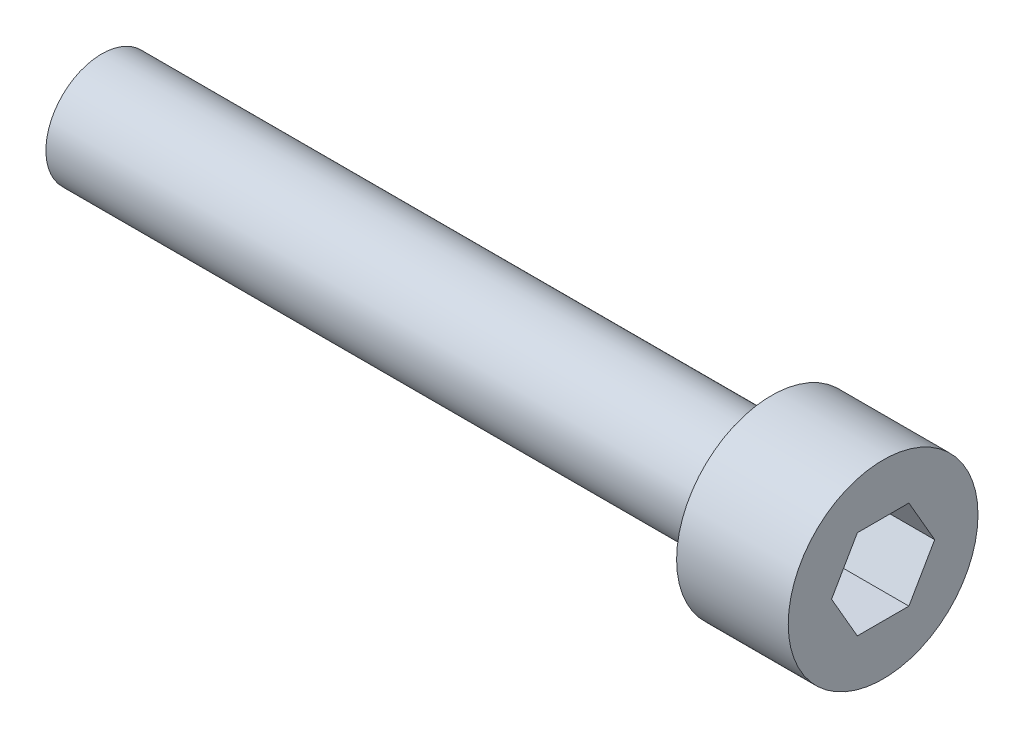
from build123d import *

# Parameters (mm, degrees)
ESQUISSE1_R             = 2.5
BOSS_EXTRU_1_DEPTH      = 30
ESQUISSE2_R             = 4.25
BOSS_EXTRU_2_DEPTH      = 5
ENL_V_MAT_EXTRU_1_DEPTH = 3.5


with BuildPart() as part:
    # Esquisse1 → Boss.-Extru.1 (new body)
    with BuildSketch(Plane(origin=(0, 0, 0), x_dir=(0, 0, -1), z_dir=(1, 0, 0))):
        Circle(ESQUISSE1_R)
    extrude(amount=BOSS_EXTRU_1_DEPTH)

    # Esquisse2 → Boss.-Extru.2 (add)
    with BuildSketch(Plane(origin=(30, 0, 0), x_dir=(0, 0, -1), z_dir=(1, 0, 0))):
        Circle(ESQUISSE2_R)
    extrude(amount=BOSS_EXTRU_2_DEPTH)

    # Esquisse3 → Enlèv. mat.-Extru.1 (cut)
    with BuildSketch(Plane(origin=(35, 0, 0), x_dir=(0, 0, -1), z_dir=(1, 0, 0))):
        Polygon((2.309401077, 0), (1.154700538, 2), (-1.154700538, 2), (-2.309401077, 0), (-1.154700538, -2), (1.154700538, -2), align=None)
    extrude(amount=-ENL_V_MAT_EXTRU_1_DEPTH, mode=Mode.SUBTRACT)


solid = part.part
